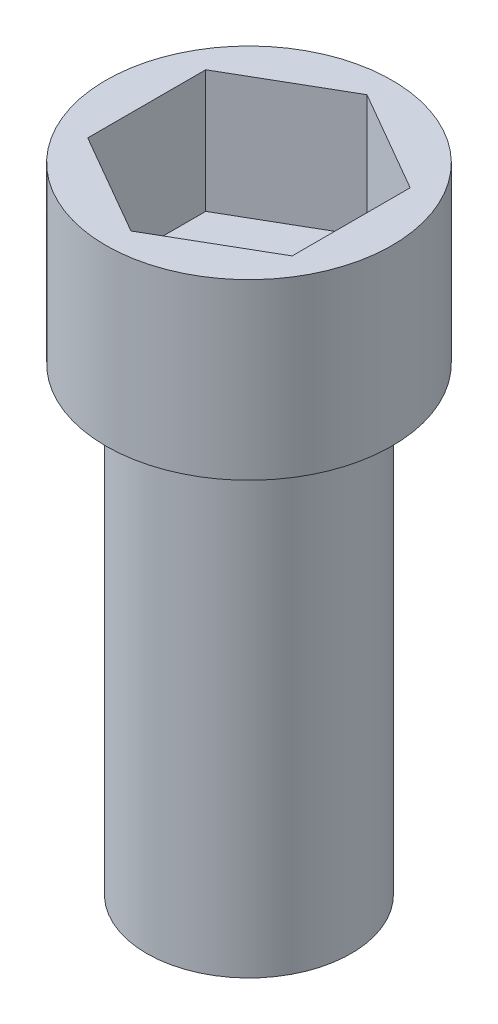
from build123d import *

# Parameters (mm, degrees)
SKETCH1_R           = 14
BOSS_EXTRUDE1_DEPTH = 17
SKETCH2_R           = 10
BOSS_EXTRUDE2_DEPTH = 45
CUT_EXTRUDE1_DEPTH  = 12


with BuildPart() as part:
    # Sketch1 → Boss-Extrude1 (new body)
    with BuildSketch(Plane(origin=(0, 0, 0), x_dir=(1, 0, 0), z_dir=(0, 1, 0))):
        with Locations(Location((0, 0, 0), (0, 0, 270))):
            Circle(SKETCH1_R)
    extrude(amount=BOSS_EXTRUDE1_DEPTH)

    # Sketch2 → Boss-Extrude2 (add)
    with BuildSketch(Plane.XZ):
        with Locations(Location((0, 0, 0), (0, 0, 90))):
            Circle(SKETCH2_R)
    extrude(amount=BOSS_EXTRUDE2_DEPTH)

    # Sketch3 → Cut-Extrude1 (cut)
    with BuildSketch(Plane(origin=(0, 17, 0), x_dir=(1, 0, 0), z_dir=(0, 1, 0))):
        Polygon((10, 5.773502692), (0, 11.547005384), (-10, 5.773502692), (-10, -5.773502692), (0, -11.547005384), (10, -5.773502692), align=None)
    extrude(amount=-CUT_EXTRUDE1_DEPTH, mode=Mode.SUBTRACT)


solid = part.part
